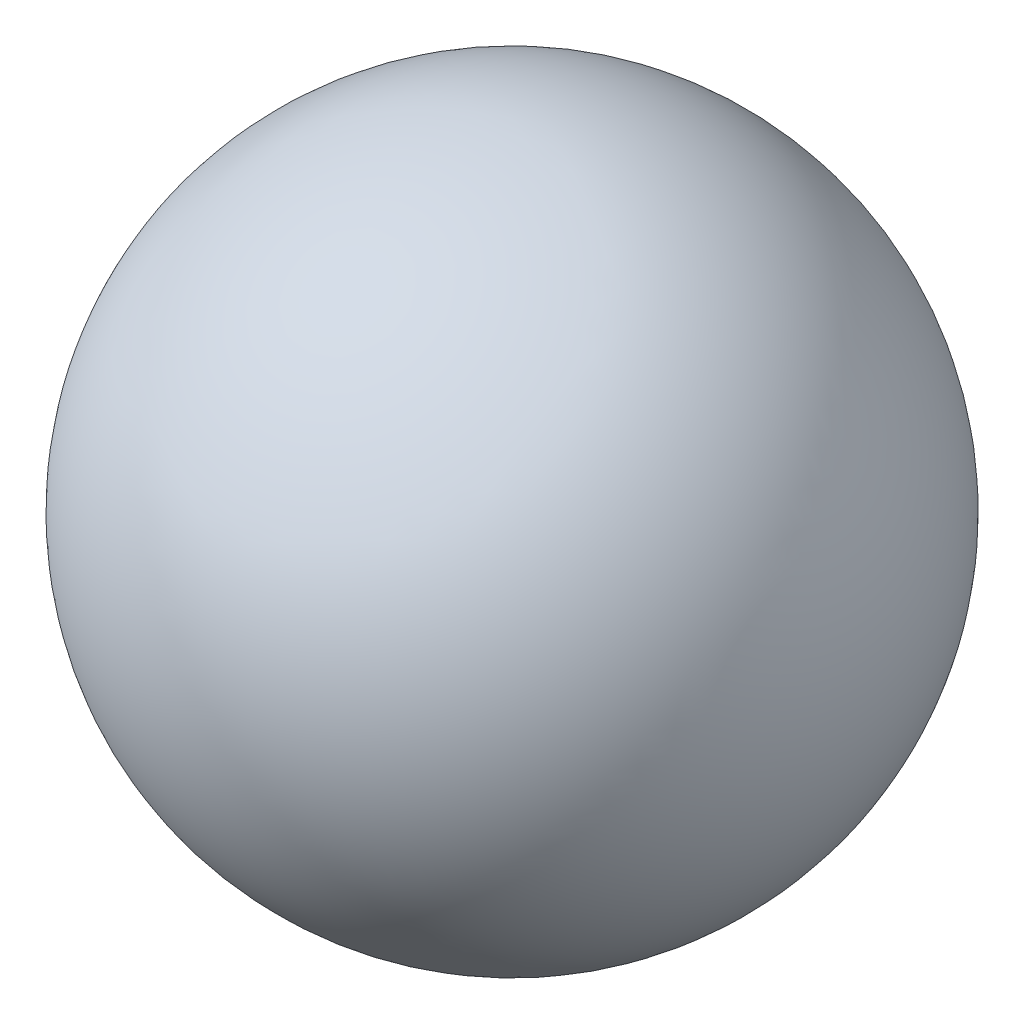
from build123d import *


with BuildPart() as part:
    # Эскиз1 → Повернуть1 (revolve)
    with BuildSketch(Plane(origin=(0, 0, 0), x_dir=(1, 0, 0), z_dir=(0, 1, 0))):
        with BuildLine():
            Line((-11, 0), (11, 0))
            ThreePointArc((11, 0), (0, 11), (-11, 0))
        make_face()
    revolve(axis=Axis((-11, 0, 0), (1, 0, 0)))


solid = part.part
